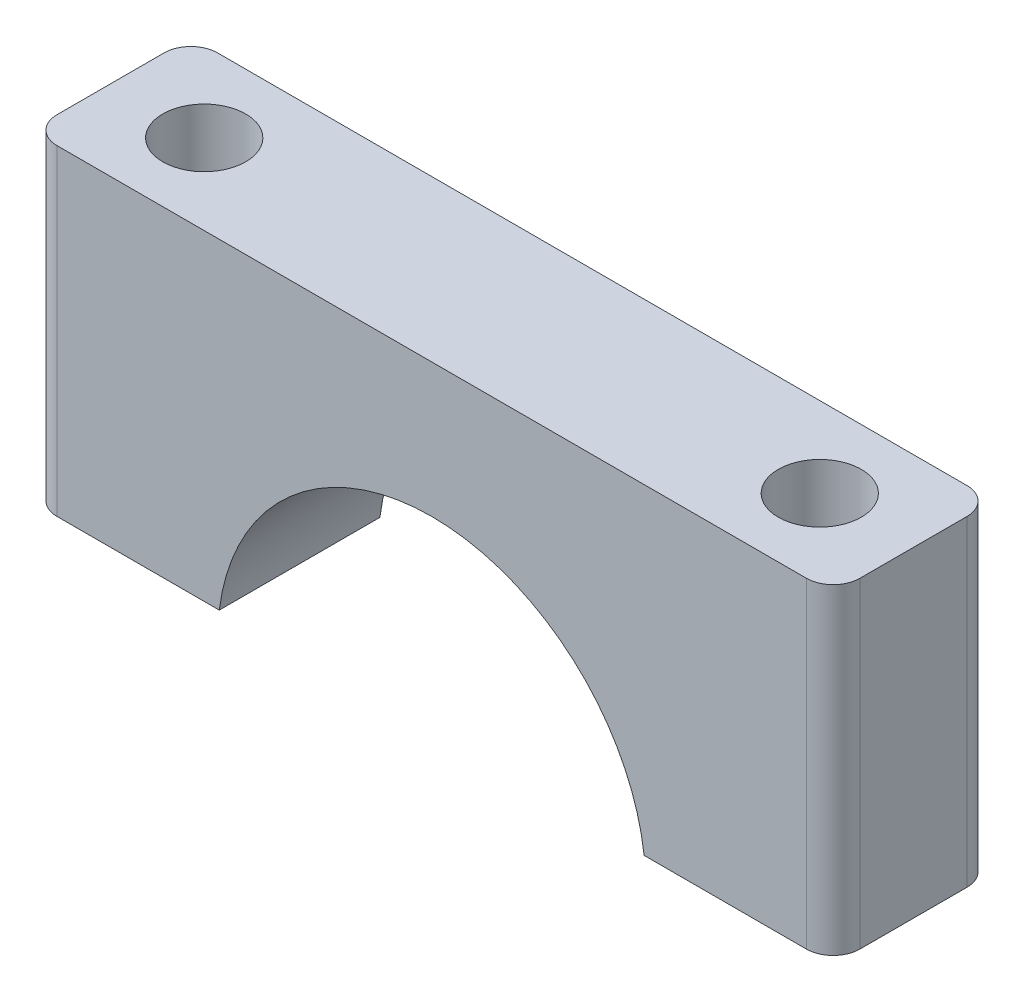
from build123d import *

# Parameters (mm, degrees)
SKETCH1_W           = 30
SKETCH1_H           = 12
BOSS_EXTRUDE1_DEPTH = 6
SKETCH2_R           = 8
CUT_EXTRUDE1_DEPTH  = 18.23368794
SKETCH3_R           = 1.55
CUT_EXTRUDE2_DEPTH  = 21.124611797
FILLET1_R           = 1


with BuildPart() as part:
    # Sketch1 → Boss-Extrude1 (new body)
    with BuildSketch(Plane.XY):
        Rectangle(SKETCH1_W, SKETCH1_H)
    extrude(amount=BOSS_EXTRUDE1_DEPTH)

    # Sketch2 → Cut-Extrude1 (cut, through all)
    with BuildSketch(Plane.XY.offset(6)):
        with Locations((0, -7)):
            Circle(SKETCH2_R)
    extrude(amount=-CUT_EXTRUDE1_DEPTH, mode=Mode.SUBTRACT)

    # Sketch3 → Cut-Extrude2 (cut, through all)
    with BuildSketch(Plane(origin=(0, 6, 0), x_dir=(1, 0, 0), z_dir=(0, 1, 0))):
        with Locations(Location((-11.5, -3, 0), (0, 0, 270))):
            Circle(SKETCH3_R)
        with Locations(Location((11.5, -3, 0), (0, 0, 270))):
            Circle(SKETCH3_R)
    extrude(amount=-CUT_EXTRUDE2_DEPTH, mode=Mode.SUBTRACT)

    # Fillet1
    fillet1_edges = [part.edges().sort_by_distance(p)[0] for p in [
        (-15, 0, 6),
        (15, 0, 6),
        (-15, 0, 0),
        (15, 0, 0),
    ]]
    fillet(fillet1_edges, radius=FILLET1_R)


solid = part.part
